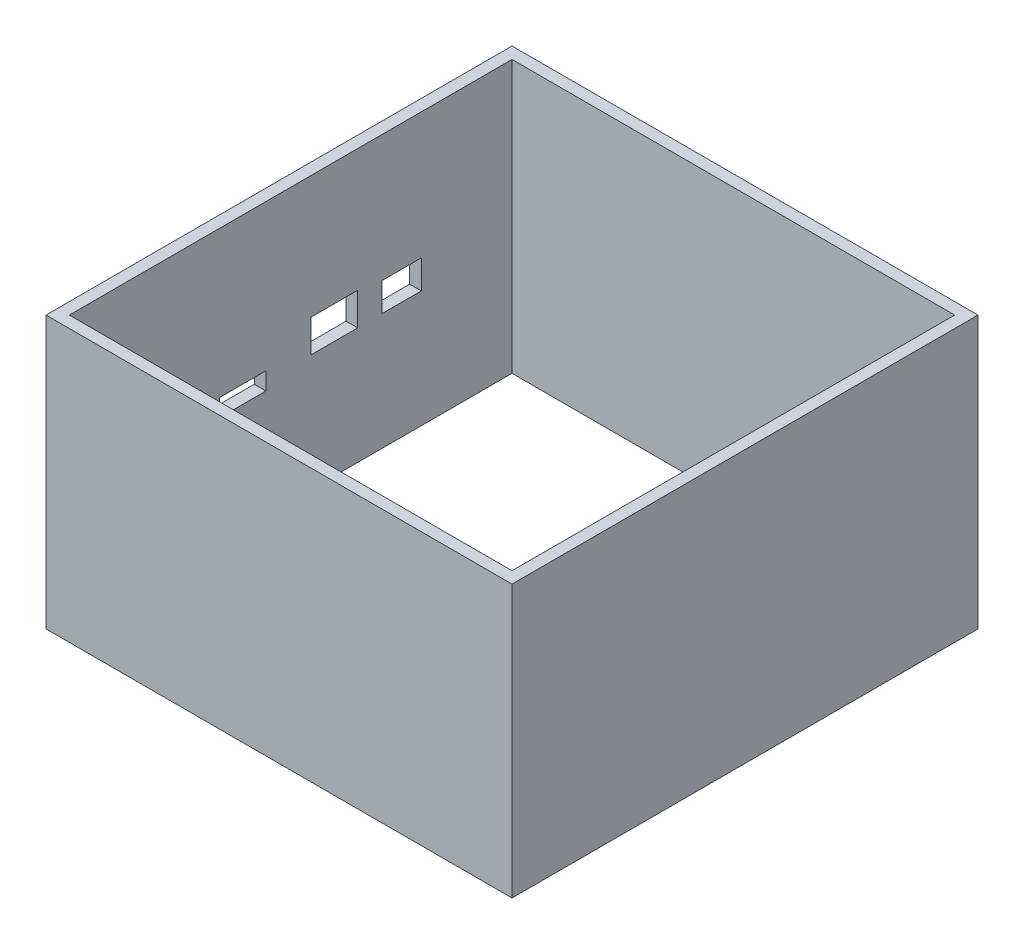
from build123d import *

# Parameters (mm, degrees)
SKETCH1_W           = 140
SKETCH1_H           = 160
BOSS_EXTRUDE1_DEPTH = 3
SKETCH2_W           = 120
SKETCH2_H           = 120
SKETCH2_W_2         = 114
SKETCH2_H_2         = 114
BOSS_EXTRUDE2_DEPTH = 70
SKETCH4_W           = 120
SKETCH4_H           = 120
BOSS_EXTRUDE4_DEPTH = 3
SKETCH5_R           = 2.1
SKETCH5_W           = 39.9
SKETCH5_H           = 19.71
CUT_EXTRUDE2_DEPTH  = 3
SKETCH6_W           = 18.298163042
SKETCH6_H           = 17.309993256
CUT_EXTRUDE3_DEPTH  = 3
CUT_EXTRUDE8_DEPTH  = 5
SKETCH15_W          = 259.021634325
SKETCH15_H          = 180.269434884
BOSS_EXTRUDE5_DEPTH = 3
SKETCH18_R          = 1.6
CUT_EXTRUDE9_DEPTH  = 10
SKETCH19_W          = 12
SKETCH19_H          = 4.5
SKETCH19_H_2        = 8.4
SKETCH19_W_2        = 10.084057066
SKETCH19_H_3        = 7.362028533
CUT_EXTRUDE11_DEPTH = 5
SKETCH20_W          = 263.921538054
SKETCH20_H          = 19.630552878
SKETCH20_W_2        = 120
SKETCH20_H_2        = 3
CUT_EXTRUDE12_DEPTH = 233.259150239
SKETCH21_W          = 259.021634325
SKETCH21_H          = 40.269434884
CUT_EXTRUDE13_DEPTH = 209.619923406


with BuildPart() as part:
    # Sketch1 → Boss-Extrude1 (new body)
    with BuildSketch(Plane(origin=(0, 0, 0), x_dir=(1, 0, 0), z_dir=(0, 1, 0))):
        Rectangle(SKETCH1_W, SKETCH1_H)
    extrude(amount=BOSS_EXTRUDE1_DEPTH)

    # Sketch2 → Boss-Extrude2 (add)
    with BuildSketch(Plane(origin=(0, 3, 0), x_dir=(1, 0, 0), z_dir=(0, 1, 0))):
        Rectangle(SKETCH2_W, SKETCH2_H)
        Rectangle(SKETCH2_W_2, SKETCH2_H_2, mode=Mode.SUBTRACT)
    extrude(amount=BOSS_EXTRUDE2_DEPTH)

    # Sketch4 → Boss-Extrude4 (add)
    with BuildSketch(Plane(origin=(0, 73, 0), x_dir=(1, 0, 0), z_dir=(0, 1, 0))):
        Rectangle(SKETCH4_W, SKETCH4_H)
    extrude(amount=BOSS_EXTRUDE4_DEPTH)

    # Sketch5 → Cut-Extrude2 (cut)
    with BuildSketch(Plane(origin=(0, 76, 0), x_dir=(1, 0, 0), z_dir=(0, 1, 0))):
        with Locations(Location((34.39, -4.925, 0), (0, 0, 270))):
            Circle(SKETCH5_R)
        with Locations(Location((34.39, 4.925, 0), (0, 0, 270))):
            Circle(SKETCH5_R)
        with Locations(Location((-15.03, -4.925, 0), (0, 0, 270))):
            Circle(SKETCH5_R)
        with Locations(Location((-15.03, 4.925, 0), (0, 0, 270))):
            Circle(SKETCH5_R)
        with Locations((9.68, 0)):
            Rectangle(SKETCH5_W, SKETCH5_H)
    extrude(amount=-CUT_EXTRUDE2_DEPTH, mode=Mode.SUBTRACT)

    # Sketch6 → Cut-Extrude3 (cut)
    with BuildSketch(Plane(origin=(0, 76, 0), x_dir=(1, 0, 0), z_dir=(0, 1, 0))):
        Rectangle(SKETCH6_W, SKETCH6_H)
    extrude(amount=-CUT_EXTRUDE3_DEPTH, mode=Mode.SUBTRACT)

    # Sketch13 → Cut-Extrude8 (cut)
    with BuildSketch(Plane(origin=(0, 76, 0), x_dir=(1, 0, 0), z_dir=(0, 1, 0))):
        with BuildLine():
            ThreePointArc((-3.792582359, 49.728765052), (-53.491503795, -1.722579942), (-0.349490011, -49.609426409))
            ThreePointArc((-0.349490011, -49.609426409), (5.82592347, -42.51288634), (-1.270616599, -36.337472859))
            ThreePointArc((-1.270616599, -36.337472859), (-40.195607742, -1.261740085), (-3.792582359, 36.42488497))
            ThreePointArc((-3.792582359, 36.42488497), (2.859357682, 43.076825011), (-3.792582359, 49.728765052))
        make_face()
    extrude(amount=-CUT_EXTRUDE8_DEPTH, mode=Mode.SUBTRACT)

    # Sketch15 → Boss-Extrude5 (add)
    with BuildSketch(Plane(origin=(0, 3, 0), x_dir=(1, 0, 0), z_dir=(0, 1, 0))):
        with Locations((-39.510817163, -10.134717442)):
            Rectangle(SKETCH15_W, SKETCH15_H)
    extrude(amount=-BOSS_EXTRUDE5_DEPTH)

    # Sketch18 → Cut-Extrude9 (cut)
    with BuildSketch(Plane(origin=(0, 3, 0), x_dir=(1, 0, 0), z_dir=(0, 1, 0))):
        with Locations(Location((-55.452, -27.227420358, 0), (0, 0, 194.647469308))):
            Circle(SKETCH18_R)
        with Locations(Location((-55.452, 32.208579642, 0), (0, 0, 194.647469308))):
            Circle(SKETCH18_R)
        with Locations(Location((4.746, 32.208579642, 0), (0, 0, 270))):
            Circle(SKETCH18_R)
        with Locations(Location((4.746, -27.227420358, 0), (0, 0, 270))):
            Circle(SKETCH18_R)
    extrude(amount=-CUT_EXTRUDE9_DEPTH, mode=Mode.SUBTRACT)

    # Sketch19 → Cut-Extrude11 (cut)
    with BuildSketch(Plane.ZY.offset(60)):
        with Locations((12.367420358, 33)):
            Rectangle(SKETCH19_W, SKETCH19_H)
        with Locations((-11.259414931, 37.2)):
            Rectangle(SKETCH19_W, SKETCH19_H_2)
        with Locations((-28.606781654, 36.742945388)):
            Rectangle(SKETCH19_W_2, SKETCH19_H_3)
    extrude(amount=-CUT_EXTRUDE11_DEPTH, mode=Mode.SUBTRACT)

    # Sketch20 → Cut-Extrude12 (cut, through all)
    with BuildSketch(Plane.XY.offset(60)):
        with Locations((-37.060865298, -6.815276439)):
            Rectangle(SKETCH20_W, SKETCH20_H)
        with Locations((0, 74.5)):
            Rectangle(SKETCH20_W_2, SKETCH20_H_2)
    extrude(amount=-CUT_EXTRUDE12_DEPTH, mode=Mode.SUBTRACT)


with BuildPart() as cut_extrude12_piece_1:
    # of the separate pieces the step leaves, piece 1, a body of its own (cut_extrude12_pieces)
    add(part.part.solids().sort_by_distance((60, 73, 60))[0])


with BuildPart() as cut_extrude12_piece_2:
    # of the separate pieces the step leaves, piece 2, a body of its own (cut_extrude12_pieces)
    add(part.part.solids().sort_by_distance((90, 0, 60))[0])

    # Sketch21 → Cut-Extrude13 (cut, through all)
    with BuildSketch(Plane(origin=(0, 3, 0), x_dir=(1, 0, 0), z_dir=(0, 1, 0))):
        with Locations((-39.510817163, -80.134717442)):
            Rectangle(SKETCH21_W, SKETCH21_H)
    extrude(amount=-CUT_EXTRUDE13_DEPTH, mode=Mode.SUBTRACT)


solid = cut_extrude12_piece_1.part
